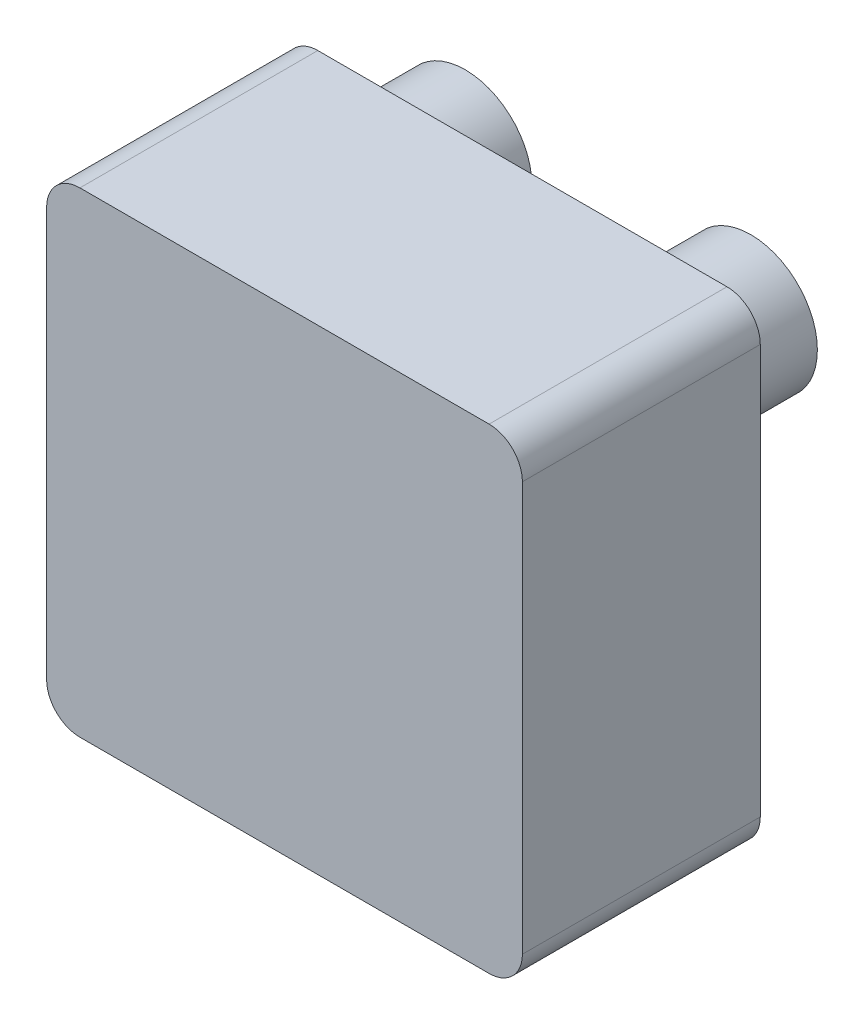
from build123d import *

# Parameters (mm, degrees)
SKETCH2_W           = 10
SKETCH2_H           = 5
BOSS_EXTRUDE2_DEPTH = 10
SKETCH3_R           = 1.4
BOSS_EXTRUDE3_DEPTH = 1.8
SKETCH4_W           = 1.85
SKETCH4_H           = 0.35
CUT_EXTRUDE1_DEPTH  = 5
SKETCH5_R           = 1.2
CUT_EXTRUDE2_DEPTH  = 3.5
FILLET1_R           = 0.7


with BuildPart() as part:
    # Sketch2 → Boss-Extrude2 (new body)
    with BuildSketch(Plane(origin=(0, 0, 0), x_dir=(1, 0, 0), z_dir=(0, 1, 0))):
        with Locations((5, 2.5)):
            Rectangle(SKETCH2_W, SKETCH2_H)
    extrude(amount=BOSS_EXTRUDE2_DEPTH)

    # Sketch3 → Boss-Extrude3 (add)
    with BuildSketch(Plane(origin=(0, 0, -5), x_dir=(-1, 0, 0), z_dir=(0, 0, -1))):
        with Locations(Location((-8, 8, 0), (0, 0, 180))):
            Circle(SKETCH3_R)
        with Locations(Location((-2, 8, 0), (0, 0, 180))):
            Circle(SKETCH3_R)
    extrude(amount=BOSS_EXTRUDE3_DEPTH)

    # Sketch4 → Cut-Extrude1 (cut)
    with BuildSketch(Plane.XZ):
        with Locations((3.425, -4.825)):
            Rectangle(SKETCH4_W, SKETCH4_H)
        with Locations((6.575, -4.825)):
            Rectangle(SKETCH4_W, SKETCH4_H)
    extrude(amount=-CUT_EXTRUDE1_DEPTH, mode=Mode.SUBTRACT)

    # Sketch5 → Cut-Extrude2 (cut)
    with BuildSketch(Plane.XZ):
        with Locations(Location((5, -2.5, 0), (0, 0, 270))):
            Circle(SKETCH5_R)
    extrude(amount=-CUT_EXTRUDE2_DEPTH, mode=Mode.SUBTRACT)

    # Fillet1
    fillet1_edges = [part.edges().sort_by_distance(p)[0] for p in [
        (10, 10, -2.5),
        (0, 10, -2.5),
        (10, 0, -2.5),
        (0, 0, -2.5),
    ]]
    fillet(fillet1_edges, radius=FILLET1_R)


solid = part.part
